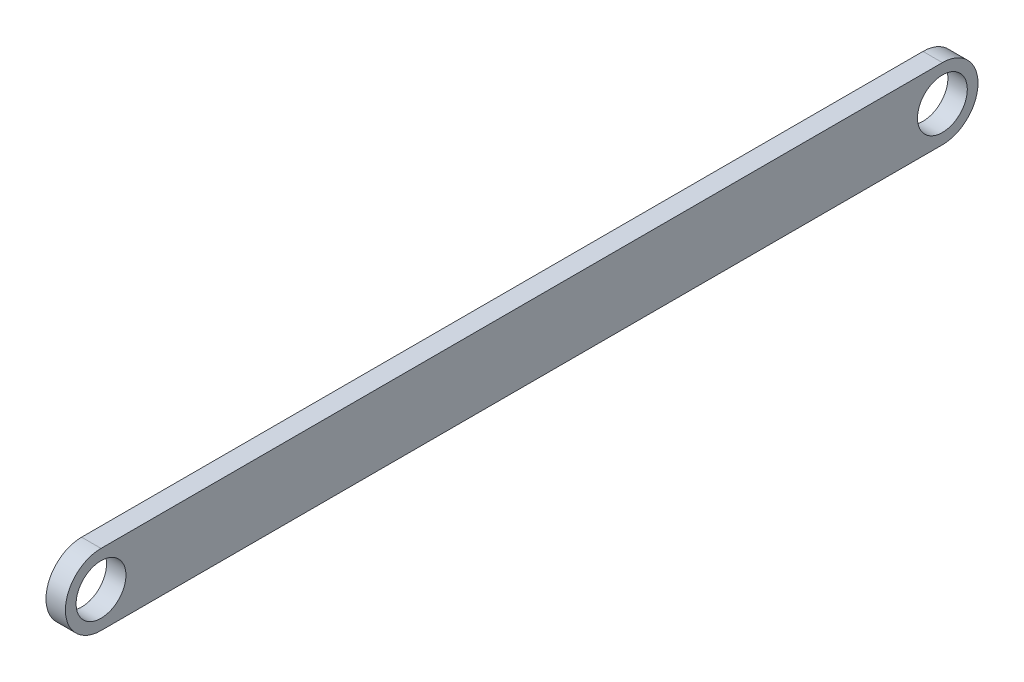
from build123d import *

# Parameters (mm, degrees)
BOSS_EXTRUDE3_DEPTH = 3
SKETCH1_7_R         = 3.85
CUT_EXTRUDE2_DEPTH  = 96.033790624


with BuildPart() as part:
    # Sketch1 → Boss-Extrude3 (new body)
    with BuildSketch(Plane(origin=(0, 0, 0), x_dir=(0, 0, -1), z_dir=(1, 0, 0))):
        with BuildLine():
            ThreePointArc((-89.17195507, 3.277158319), (-94.67195507, -2.222841681), (-89.17195507, -7.722841681))
            Line((-89.17195507, -7.722841681), (40.82804493, -7.722841681))
            ThreePointArc((40.82804493, -7.722841681), (46.32804493, -2.222841681), (40.82804493, 3.277158319))
            Line((40.82804493, 3.277158319), (-89.17195507, 3.277158319))
        make_face()
    extrude(amount=BOSS_EXTRUDE3_DEPTH)

    # Sketch1<7> → Cut-Extrude2 (cut, through all)
    with BuildSketch(Plane(origin=(0, 0, 0), x_dir=(0, 0, -1), z_dir=(1, 0, 0))):
        with Locations((-89.17195507, -2.222841681)):
            Circle(SKETCH1_7_R)
        with Locations((40.82804493, -2.222841681)):
            Circle(SKETCH1_7_R)
    extrude(amount=CUT_EXTRUDE2_DEPTH, mode=Mode.SUBTRACT)


solid = part.part
